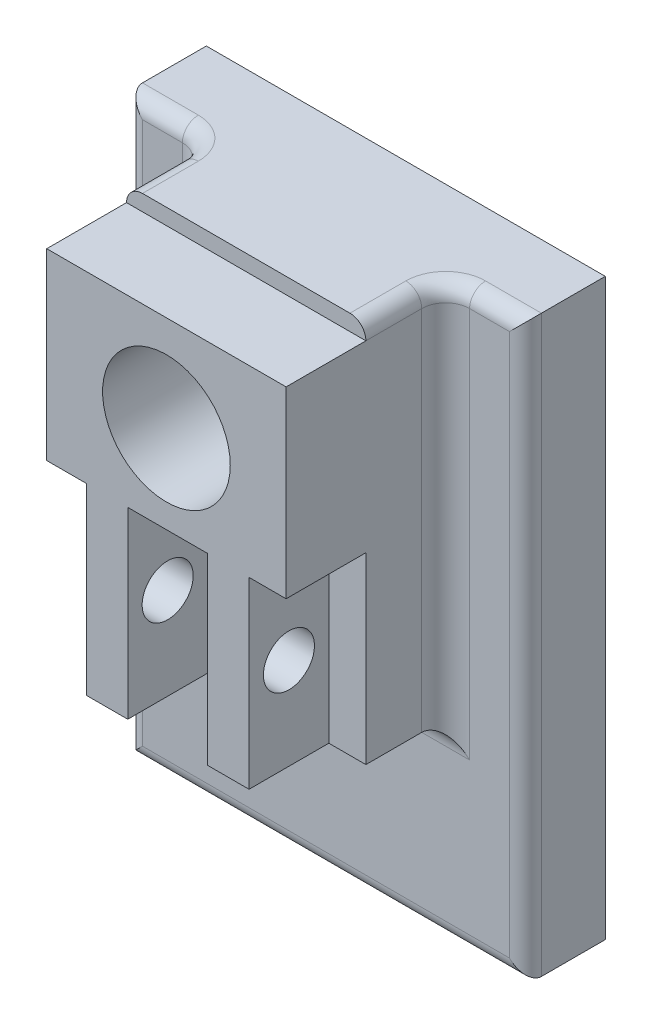
from build123d import *

# Parameters (mm, degrees)
SKETCH1_W           = 125
SKETCH1_H           = 180
BASE_EXTRUDE_DEPTH  = 25
SKETCH2_W           = 75
SKETCH2_H           = 120
BOSS_EXTRUDE1_DEPTH = 25
FILLET2_R           = 7.5
FILLET4_R           = 5
SKETCH4_W           = 75
SKETCH4_H           = 57.5
BOSS_EXTRUDE2_DEPTH = 25
SKETCH7_R           = 20
CUT_EXTRUDE2_DEPTH  = 105
SKETCH8_W           = 13
SKETCH8_H           = 57.5
BOSS_EXTRUDE4_DEPTH = 25
SKETCH9_R           = 8
CUT_EXTRUDE3_DEPTH  = 80


with BuildPart() as part:
    # Sketch1 → Base-Extrude (new body)
    with BuildSketch(Plane.XY):
        with Locations((-7.794747082, 12.712840467)):
            Rectangle(SKETCH1_W, SKETCH1_H)
    extrude(amount=BASE_EXTRUDE_DEPTH)

    # Sketch2 → Boss-Extrude1 (add)
    with BuildSketch(Plane.XY.offset(25)):
        with Locations((-7.794747082, 42.712840467)):
            Rectangle(SKETCH2_W, SKETCH2_H)
    extrude(amount=BOSS_EXTRUDE1_DEPTH)

    # Fillet2
    fillet2_edges = [part.edges().sort_by_distance(p)[0] for p in [
        (-45.294747082, 42.712840467, 25),
        (-7.794747082, -17.287159533, 25),
        (29.705252918, 42.712840467, 25),
    ]]
    fillet(fillet2_edges, radius=FILLET2_R)

    # Fillet4
    fillet4_edges = [part.edges().sort_by_distance(p)[0] for p in [
        (54.705252918, 12.712840467, 25),
        (-61.544747082, 102.712840467, 25),
        (-45.294747082, 102.712840467, 41.25),
        (29.705252918, 102.712840467, 41.25),
        (31.901952059, 102.712840467, 27.196699141),
        (-47.491446223, 102.712840467, 27.196699141),
        (-70.294747082, 12.712840467, 25),
        (-7.794747082, -77.287159533, 25),
    ]]
    fillet(fillet4_edges, radius=FILLET4_R)

    # Sketch4 → Boss-Extrude2 (add)
    with BuildSketch(Plane.XY.offset(50)):
        with Locations((-7.794747082, 68.962840467)):
            Rectangle(SKETCH4_W, SKETCH4_H)
    extrude(amount=BOSS_EXTRUDE2_DEPTH)

    # Sketch7 → Cut-Extrude2 (cut)
    with BuildSketch(Plane.XY.offset(75)):
        with Locations((-7.794747082, 67.712840467)):
            Circle(SKETCH7_R)
    extrude(amount=-CUT_EXTRUDE2_DEPTH, mode=Mode.SUBTRACT)

    # Sketch8 → Boss-Extrude4 (add)
    with BuildSketch(Plane.XY.offset(50)):
        with Locations((11.592907965, 11.462840467)):
            Rectangle(SKETCH8_W, SKETCH8_H)
        with Locations((-26.407092035, 11.462840467)):
            Rectangle(SKETCH8_W, SKETCH8_H)
    extrude(amount=BOSS_EXTRUDE4_DEPTH)

    # Sketch9 → Cut-Extrude3 (cut)
    with BuildSketch(Plane.ZY.offset(32.907092035)):
        with Locations((62.5, 11.462840467)):
            Circle(SKETCH9_R)
    extrude(amount=-CUT_EXTRUDE3_DEPTH, mode=Mode.SUBTRACT)


solid = part.part
